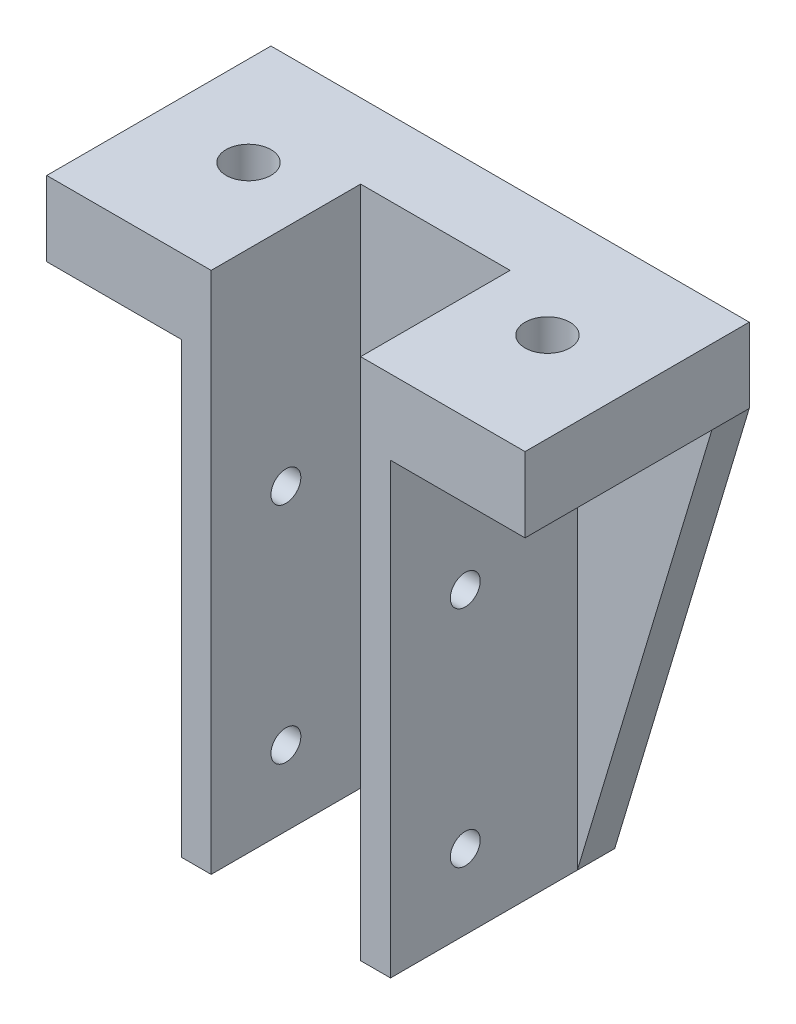
from build123d import *

# Parameters (mm, degrees)
SKETCH_1_W          = 28
SKETCH_1_H          = 70
EXTRUDE_1_DEPTH     = 30
SKETCH_2_W          = 20
SKETCH_2_H          = 70
CUT_EXTRUDE_1_DEPTH = 20
SKETCH_4_W          = 18
SKETCH_4_H          = 30
EXTRUDE_2_DEPTH     = 10
SKETCH_5_R          = 3
CUT_EXTRUDE_2_DEPTH = 19
EXTRUDE_3_DEPTH     = 5
SKETCH_8_R          = 2
CUT_EXTRUDE_3_DEPTH = 98
SKETCH_9_R          = 2
CUT_EXTRUDE_4_DEPTH = 98


with BuildPart() as part:
    # 草图1 → 凸台-拉伸1 (new body)
    with BuildSketch(Plane.XY):
        Rectangle(SKETCH_1_W, SKETCH_1_H)
    extrude(amount=EXTRUDE_1_DEPTH)

    # 草图2 → 切除-拉伸1 (cut)
    with BuildSketch(Plane.XY.offset(30)):
        Rectangle(SKETCH_2_W, SKETCH_2_H)
    extrude(amount=-CUT_EXTRUDE_1_DEPTH, mode=Mode.SUBTRACT)

    # 草图4 → 凸台-拉伸2 (add)
    with BuildSketch(Plane(origin=(0, 35, 0), x_dir=(1, 0, 0), z_dir=(0, 1, 0))):
        with Locations((23, -15)):
            Rectangle(SKETCH_4_W, SKETCH_4_H)
    extrude(amount=-EXTRUDE_2_DEPTH)

    # 草图5 → 切除-拉伸2 (cut)
    with BuildSketch(Plane(origin=(0, 35, 0), x_dir=(1, 0, 0), z_dir=(0, 1, 0))):
        with Locations(Location((20, -15, 0), (0, 0, 270))):
            Circle(SKETCH_5_R)
    extrude(amount=-CUT_EXTRUDE_2_DEPTH, mode=Mode.SUBTRACT)

    # 草图7 → 凸台-拉伸3 (add)
    with BuildSketch(Plane(origin=(0, 0, 0), x_dir=(-1, 0, 0), z_dir=(0, 0, -1))):
        Polygon((-32, 25), (-14, -35), (-14, 25), align=None)
    extrude(amount=-EXTRUDE_3_DEPTH)

    # 镜向1: part across plane


with BuildPart() as part_1:
    add(part.part)
    add(part.part.mirror(Plane(origin=(0, 0, 0), x_dir=(0, 0, 1), z_dir=(1, 0, 0))))

    # 草图8 → 切除-拉伸3 (cut)
    with BuildSketch(Plane(origin=(14, 0, 0), x_dir=(0, 0, -1), z_dir=(1, 0, 0))):
        with Locations(Location((-20, -25, 0), (0, 0, 90))):
            Circle(SKETCH_8_R)
        with Locations(Location((-20, 5, 0), (0, 0, 90))):
            Circle(SKETCH_8_R)
    extrude(amount=-CUT_EXTRUDE_3_DEPTH, mode=Mode.SUBTRACT)

    # 草图9 → 切除-拉伸4 (cut)
    with BuildSketch(Plane.XY.offset(10)):
        with Locations((0, -20)):
            Circle(SKETCH_9_R)
        with Locations((0, 20)):
            Circle(SKETCH_9_R)
    extrude(amount=-CUT_EXTRUDE_4_DEPTH, mode=Mode.SUBTRACT)


solid = part_1.part
